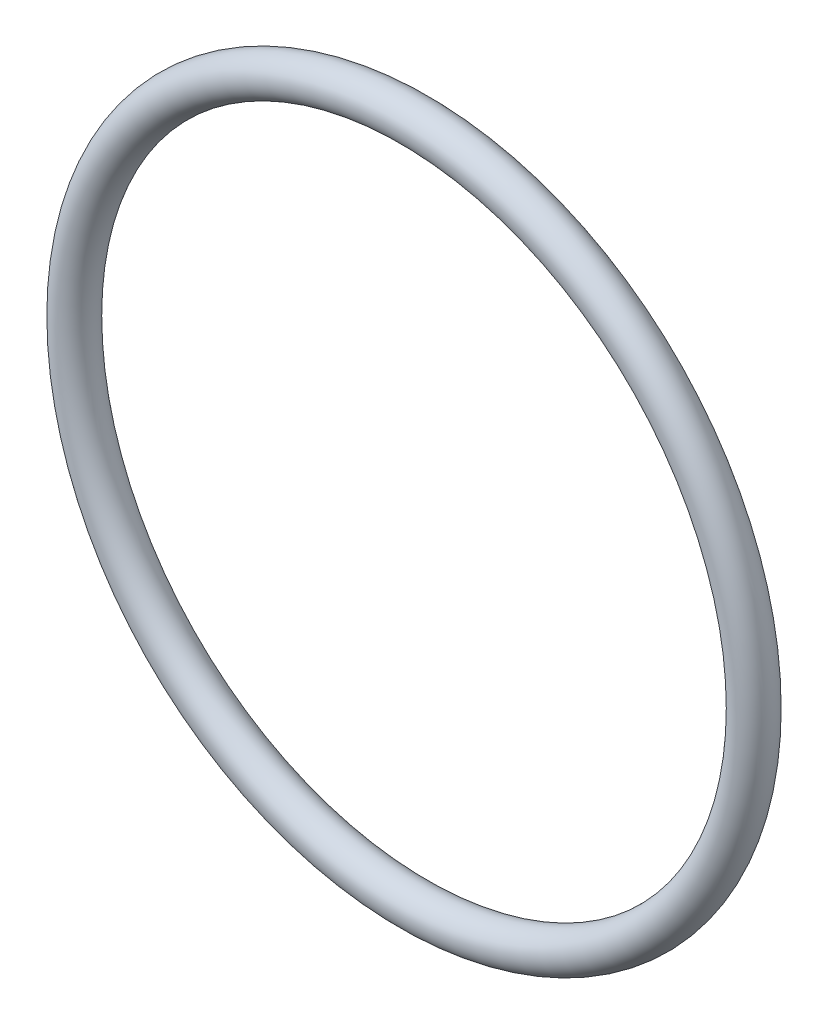
from build123d import *

# Parameters (mm, degrees)
SKICA1_R = 1


with BuildPart() as part:
    # Skica1 → Rotovat1 (revolve)
    with BuildSketch(Plane(origin=(0, 0, 0), x_dir=(1, 0, 0), z_dir=(0, 1, 0)), mode=Mode.PRIVATE) as rotovat1_sk:
        Circle(SKICA1_R)
    revolve(rotovat1_sk.sketch.rotate(Axis((-17.5, 0, -35.240383783), (0, 0, 1)), 180), axis=Axis((-17.5, 0, -35.240383783), (0, 0, 1)))


solid = part.part
